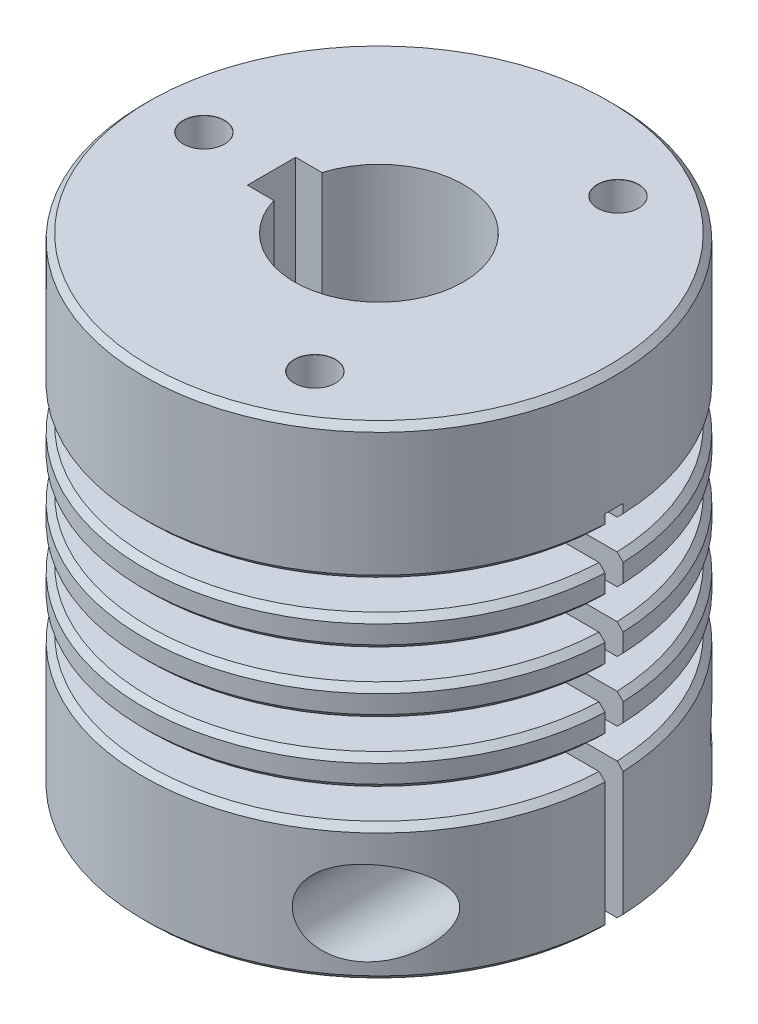
from build123d import *

# Parameters (mm, degrees)
SKETCH4_R                            = 39
BOSS_EXTRUDE1_DEPTH                  = 80
SKETCH7_W                            = 30
SKETCH7_H                            = 3
CUT_EXTRUDE1_DEPTH                   = 60
SKETCH9_R                            = 3.4
CUT_EXTRUDE2_DEPTH                   = 98.169954204
SKETCH10_R                           = 4
CUT_EXTRUDE3_DEPTH                   = 98.169954367
CUT_EXTRUDE4_START                   = 10
SKETCH11_R                           = 7
CUT_EXTRUDE4_DEPTH                   = 88.169954367
SKETCH14_W                           = 10
SKETCH14_H                           = 5
LPATTERN2_COUNT                      = 4
LPATTERN2_PITCH                      = 10
CHAMFER1_SIZE                        = 1
F_6_8_6_8_DIAMETER_HOLE1_D           = 6.8
F_6_8_6_8_DIAMETER_HOLE1_DEPTH       = 20
F_6_8_6_8_DIAMETER_HOLE1_CSINK_D     = 6.85
F_6_8_6_8_DIAMETER_HOLE1_CSINK_ANGLE = 90
F_6_8_6_8_DIAMETER_HOLE1_TIP         = 2.042926105


with BuildPart() as part:
    # Sketch4 → Boss-Extrude1 (new body)
    with BuildSketch(Plane(origin=(0, 0, 0), x_dir=(1, 0, 0), z_dir=(0, 1, 0))):
        with Locations(Location((0, 0, 0), (0, 0, 270))):
            Circle(SKETCH4_R)
        with BuildLine():
            Line((-17.8, 4), (-17.8, -4))
            Line((-17.8, -4), (-13.416407865, -4))
            ThreePointArc((-13.416407865, -4), (14, 0), (-13.416407865, 4))
            Line((-13.416407865, 4), (-17.8, 4))
        make_face(mode=Mode.SUBTRACT)
    extrude(amount=BOSS_EXTRUDE1_DEPTH)

    # Sketch7 → Cut-Extrude1 (cut)
    with BuildSketch(Plane.XZ):
        with Locations((26.5, 0)):
            Rectangle(SKETCH7_W, SKETCH7_H)
    extrude(amount=-CUT_EXTRUDE1_DEPTH, mode=Mode.SUBTRACT)

    # Sketch9 → Cut-Extrude2 (cut, through all)
    with BuildSketch(Plane.XY):
        with Locations((26.445277039, 10)):
            Circle(SKETCH9_R)
    extrude(amount=-CUT_EXTRUDE2_DEPTH, mode=Mode.SUBTRACT)

    # Sketch10 → Cut-Extrude3 (cut, through all)
    with BuildSketch(Plane.XY):
        with Locations(Location((26.445277039, 10, 0), (0, 0, 180))):
            Circle(SKETCH10_R)
    extrude(amount=CUT_EXTRUDE3_DEPTH, mode=Mode.SUBTRACT)

    # Sketch11 → Cut-Extrude4 (cut, through all)
    with BuildSketch(Plane.XY.offset(CUT_EXTRUDE4_START)):
        with Locations(Location((26.445277039, 10, 0), (0, 0, 180))):
            Circle(SKETCH11_R)
    extrude(amount=CUT_EXTRUDE4_DEPTH, mode=Mode.SUBTRACT)

    # Sketch14 → Cut-Revolve5 (revolve, cut)
    with BuildSketch(Plane.XY, mode=Mode.PRIVATE) as cut_revolve5_sk:
        with Locations((-34, 55)):
            Rectangle(SKETCH14_W, SKETCH14_H)
    cut_revolve5 = revolve(cut_revolve5_sk.sketch.rotate(Axis((0, 0, 0), (0, 1, 0)), 182.204227504), axis=Axis((0, 0, 0), (0, 1, 0)), mode=Mode.SUBTRACT)

    # LPattern2: Cut-Revolve5 ×4
    with Locations(*[(0, -i * LPATTERN2_PITCH, 0) for i in range(1, LPATTERN2_COUNT)]):
        add(cut_revolve5, mode=Mode.SUBTRACT)

    # Chamfer1
    chamfer1_edges = [part.edges().sort_by_distance(p)[0] for p in [
        (-28.102490993, 27.5, -27.041634566),
        (-28.102490993, 22.5, -27.041634566),
        (-28.102490993, 0, -27.041634566),
        (0, 80, -39),
        (-28.102490993, 57.5, -27.041634566),
        (-28.102490993, 52.5, -27.041634566),
        (-28.102490993, 47.5, -27.041634566),
        (-28.102490993, 42.5, -27.041634566),
        (-28.102490993, 37.5, -27.041634566),
        (-28.102490993, 32.5, -27.041634566),
    ]]
    chamfer(chamfer1_edges, length=CHAMFER1_SIZE)

    # Ø6.8 (6.8) Diameter Hole1
    with Locations(Plane(origin=(0, 80, 0), x_dir=(1, 0, 0), z_dir=(0, 1, 0))):
        with Locations((14.5, -25.11473671), (-29, 0), (14.5, 25.11473671), (-2.395896041, 7.986320136)):
            CounterSinkHole(F_6_8_6_8_DIAMETER_HOLE1_D / 2, F_6_8_6_8_DIAMETER_HOLE1_CSINK_D / 2, depth=F_6_8_6_8_DIAMETER_HOLE1_DEPTH, counter_sink_angle=F_6_8_6_8_DIAMETER_HOLE1_CSINK_ANGLE)
            with Locations((0, 0, -(F_6_8_6_8_DIAMETER_HOLE1_DEPTH + F_6_8_6_8_DIAMETER_HOLE1_TIP / 2))):  # 118° drill point
                Cone(0, F_6_8_6_8_DIAMETER_HOLE1_D / 2, F_6_8_6_8_DIAMETER_HOLE1_TIP, mode=Mode.SUBTRACT)


solid = part.part
